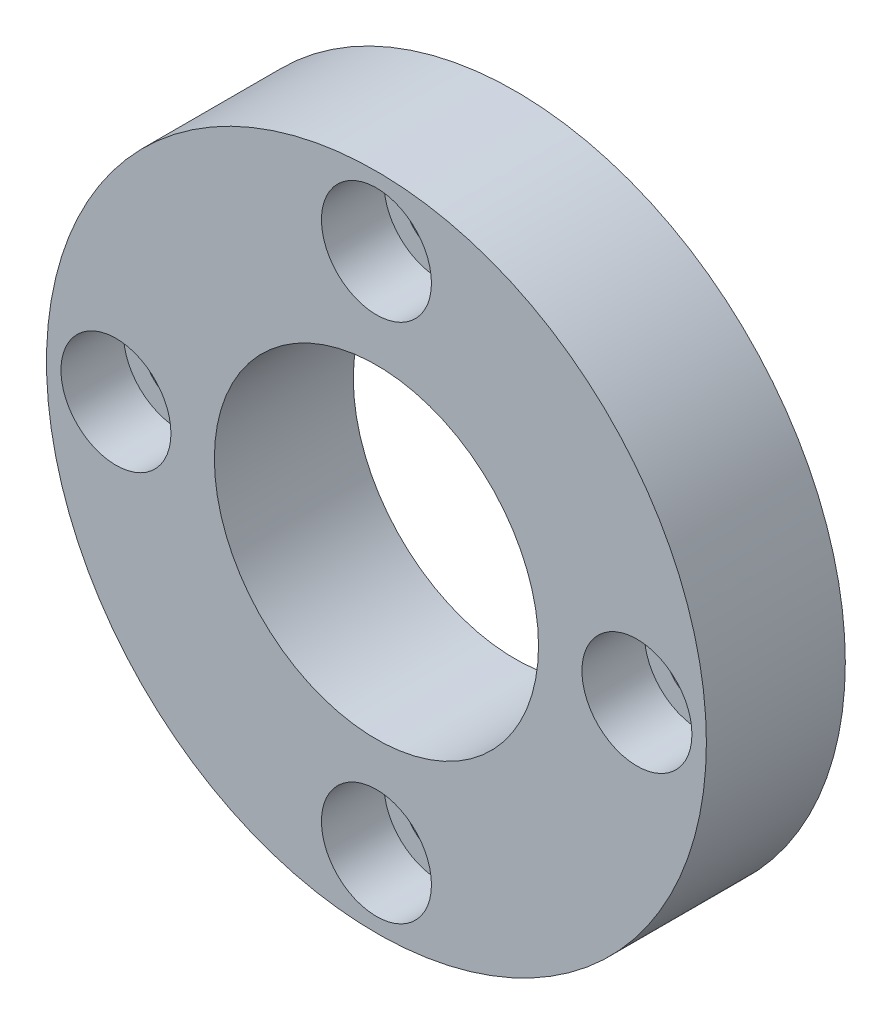
from build123d import *

# Parameters (mm, degrees)
SKETCH_1_R          = 28.5
SKETCH_1_R_2        = 14
SKETCH_1_R_3        = 3
EXTRUDE_1_DEPTH     = 12
SKETCH_2_R          = 4.75
CUT_EXTRUDE_1_DEPTH = 5.4


with BuildPart() as part:
    # 草图1 → 凸台-拉伸1 (new body)
    with BuildSketch(Plane.XY):
        Circle(SKETCH_1_R)
        Circle(SKETCH_1_R_2, mode=Mode.SUBTRACT)
        with Locations((0, 22.5)):
            Circle(SKETCH_1_R_3, mode=Mode.SUBTRACT)
        with Locations((22.5, 0)):
            Circle(SKETCH_1_R_3, mode=Mode.SUBTRACT)
        with Locations((0, -22.5)):
            Circle(SKETCH_1_R_3, mode=Mode.SUBTRACT)
        with Locations((-22.5, 0)):
            Circle(SKETCH_1_R_3, mode=Mode.SUBTRACT)
    extrude(amount=EXTRUDE_1_DEPTH)

    # 草图2 → 切除-拉伸1 (cut)
    with BuildSketch(Plane.XY.offset(12)):
        with Locations((0, 22.5)):
            Circle(SKETCH_2_R)
        with Locations((22.5, 0)):
            Circle(SKETCH_2_R)
        with Locations((0, -22.5)):
            Circle(SKETCH_2_R)
        with Locations((-22.5, 0)):
            Circle(SKETCH_2_R)
    extrude(amount=-CUT_EXTRUDE_1_DEPTH, mode=Mode.SUBTRACT)


solid = part.part
